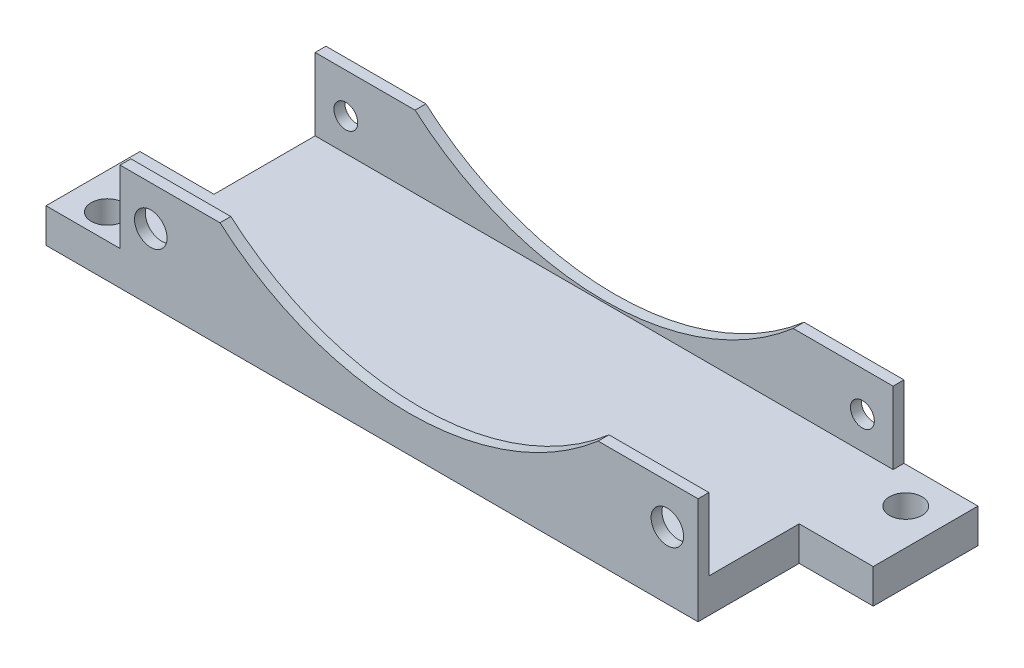
from build123d import *

# Parameters (mm, degrees)
SKETCH1_W                 = 80
SKETCH1_H                 = 14.75
BOSS_EXTRUDE1_DEPTH       = 28.5
SKETCH7_W                 = 25.5
SKETCH7_H                 = 10
CUT_EXTRUDE3_DEPTH        = 86.244592937
M4X0_7_TAPPED_HOLE3_D     = 3.3
M4X0_7_TAPPED_HOLE3_DEPTH = 1.5
M4_CLEARANCE_HOLE1_D      = 4.5
M4_CLEARANCE_HOLE1_DEPTH  = 1.5
SKETCH15_R                = 40
CUT_EXTRUDE4_DEPTH        = 50.665285915
BOSS_EXTRUDE3_START       = -4.75
SKETCH19_W                = 10.25
SKETCH19_H                = 13
SKETCH19_H_2              = 14.5
BOSS_EXTRUDE3_DEPTH       = 4.75
M4_CLEARANCE_HOLE3_D      = 4.5


with BuildPart() as part:
    # Sketch1 → Boss-Extrude1 (new body)
    with BuildSketch(Plane.XY):
        Rectangle(SKETCH1_W, SKETCH1_H)
    extrude(amount=BOSS_EXTRUDE1_DEPTH)

    # Sketch7 → Cut-Extrude3 (cut, through all)
    with BuildSketch(Plane.ZY.offset(40)):
        with Locations((14.25, 2.375)):
            Rectangle(SKETCH7_W, SKETCH7_H)
    extrude(amount=-CUT_EXTRUDE3_DEPTH, mode=Mode.SUBTRACT)

    # M4x0.7 Tapped Hole3
    with Locations(Plane.XY.offset(1.5)):
        with Locations((-35.75, 1.875), (35.75, 1.875)):
            Hole(M4X0_7_TAPPED_HOLE3_D / 2, depth=M4X0_7_TAPPED_HOLE3_DEPTH)

    # M4 Clearance Hole1
    with Locations(Plane(origin=(0, 0, 27), x_dir=(-1, 0, 0), z_dir=(0, 0, -1))):
        with Locations((-35.75, 1.875), (35.75, 1.875)):
            Hole(M4_CLEARANCE_HOLE1_D / 2, depth=M4_CLEARANCE_HOLE1_DEPTH)

    # Sketch15 → Cut-Extrude4 (cut, through all)
    with BuildSketch(Plane.XY.offset(28.5)):
        with Locations((0, 37.625)):
            Circle(SKETCH15_R)
    extrude(amount=-CUT_EXTRUDE4_DEPTH, mode=Mode.SUBTRACT)

    # Sketch19 → Boss-Extrude3 (add)
    with BuildSketch(Plane.XZ.offset(7.375).offset(BOSS_EXTRUDE3_START)):
        with Locations((-45.125, 22)):
            Rectangle(SKETCH19_W, SKETCH19_H)
        with Locations((45.125, 7.25)):
            Rectangle(SKETCH19_W, SKETCH19_H_2)
    extrude(amount=BOSS_EXTRUDE3_DEPTH)

    # M4 Clearance Hole3 (through all)
    with Locations(Plane(origin=(0, -2.625, 0), x_dir=(1, 0, 0), z_dir=(0, 1, 0))):
        with Locations((-45.25, -25), (45.25, -5)):
            Hole(M4_CLEARANCE_HOLE3_D / 2)


solid = part.part
